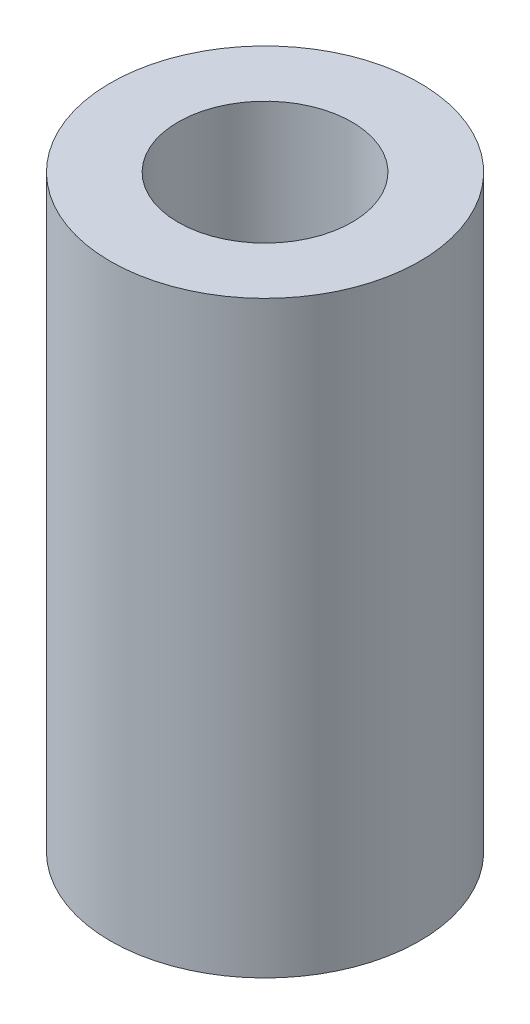
from build123d import *

# Parameters (mm, degrees)
SKETCH1_R           = 2.90195
SKETCH1_R_2         = 1.63195
BOSS_EXTRUDE1_DEPTH = 11.049


with BuildPart() as part:
    # Sketch1 → Boss-Extrude1 (new body)
    with BuildSketch(Plane(origin=(0, 0, 0), x_dir=(1, 0, 0), z_dir=(0, 1, 0))):
        with Locations(Location((0, 0, 0), (0, 0, 270))):
            Circle(SKETCH1_R)
        with Locations(Location((0, 0, 0), (0, 0, 270))):
            Circle(SKETCH1_R_2, mode=Mode.SUBTRACT)
    extrude(amount=BOSS_EXTRUDE1_DEPTH)


solid = part.part
